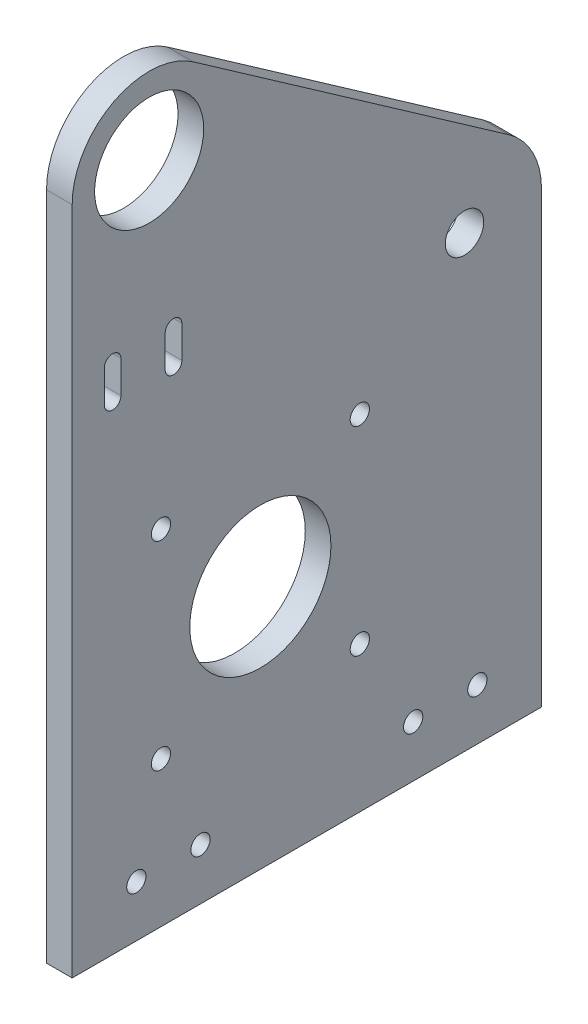
from build123d import *

# Parameters (mm, degrees)
SKETCH_1_R      = 3
SKETCH_1_R_2    = 8.5
SKETCH_1_R_3    = 11
SKETCH_1_R_4    = 1.5
EXTRUDE_1_DEPTH = 4


with BuildPart() as part:
    # 草图1 → 凸台-拉伸1 (new body)
    with BuildSketch(Plane(origin=(0, 0, 0), x_dir=(0, 0, -1), z_dir=(1, 0, 0))):
        with BuildLine():
            Line((-42.273933648, 44.23702673), (6.8812, 9.83102673))
            ThreePointArc((6.8812, 9.83102673), (10.643645992, 5.541913027), (12, 0))
            Line((12, 0), (12, -70))
            Line((12, -70), (-61.155133648, -70))
            Line((-61.155133648, -70), (-61.155133648, 34.406))
            ThreePointArc((-61.155133648, 34.406), (-54.697046676, 45.049645992), (-42.273933648, 44.23702673))
        make_face()
        Circle(SKETCH_1_R, mode=Mode.SUBTRACT)
        with Locations((-49.155133648, 34.406)):
            Circle(SKETCH_1_R_2, mode=Mode.SUBTRACT)
        with Locations((-31.819805153, -31.819805153)):
            Circle(SKETCH_1_R_3, mode=Mode.SUBTRACT)
        with Locations((2, -62)):
            Circle(SKETCH_1_R_4, mode=Mode.SUBTRACT)
        with Locations((-8, -62)):
            Circle(SKETCH_1_R_4, mode=Mode.SUBTRACT)
        with Locations((-41.155133648, -62)):
            Circle(SKETCH_1_R_4, mode=Mode.SUBTRACT)
        with Locations((-51.155133648, -62)):
            Circle(SKETCH_1_R_4, mode=Mode.SUBTRACT)
        with Locations((-16.319805153, -16.319805153)):
            Circle(SKETCH_1_R_4, mode=Mode.SUBTRACT)
        with Locations((-16.319805153, -47.319805147)):
            Circle(SKETCH_1_R_4, mode=Mode.SUBTRACT)
        with Locations((-47.319805147, -47.319805147)):
            Circle(SKETCH_1_R_4, mode=Mode.SUBTRACT)
        with Locations((-47.319805147, -16.319805153)):
            Circle(SKETCH_1_R_4, mode=Mode.SUBTRACT)
        with BuildLine():
            Line((-53.555133648, 9.83102673), (-53.555133648, 4.83102673))
            ThreePointArc((-53.555133648, 4.83102673), (-54.855133648, 3.53102673), (-56.155133648, 4.83102673))
            Line((-56.155133648, 4.83102673), (-56.155133648, 9.83102673))
            ThreePointArc((-56.155133648, 9.83102673), (-54.855133648, 11.13102673), (-53.555133648, 9.83102673))
        make_face(mode=Mode.SUBTRACT)
        with BuildLine():
            Line((-44.055133648, 9.83102673), (-44.055133648, 4.83102673))
            ThreePointArc((-44.055133648, 4.83102673), (-45.355133648, 3.53102673), (-46.655133648, 4.83102673))
            Line((-46.655133648, 4.83102673), (-46.655133648, 9.83102673))
            ThreePointArc((-46.655133648, 9.83102673), (-45.355133648, 11.13102673), (-44.055133648, 9.83102673))
        make_face(mode=Mode.SUBTRACT)
    extrude(amount=EXTRUDE_1_DEPTH)


solid = part.part
